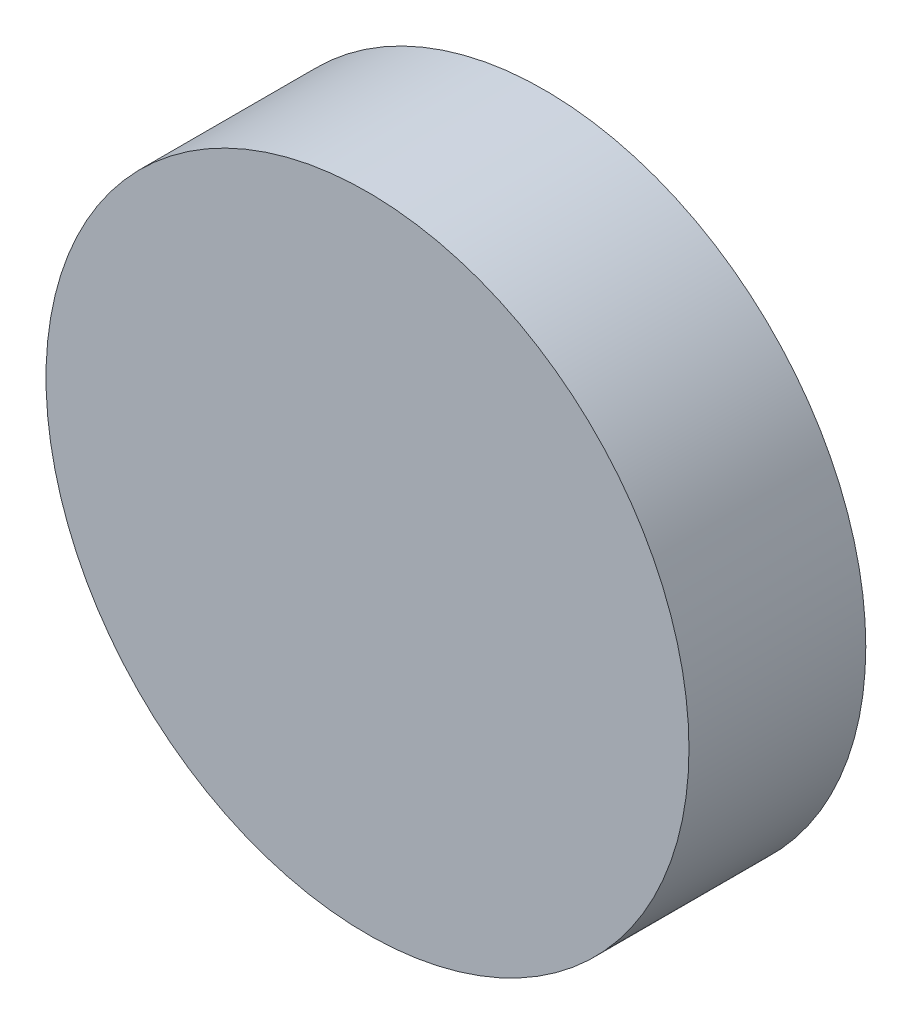
from build123d import *

# Parameters (mm, degrees)
EXTRUDE_START      = 800
EXTRUDE_SKETCH_1_R = 40
EXTRUDE_1_DEPTH    = 22


with BuildPart() as part:
    # Extrude sketch 1 → Extrude 1 (new body)
    with BuildSketch(Plane.XY.offset(EXTRUDE_START)):
        with Locations((860, 225)):
            Circle(EXTRUDE_SKETCH_1_R)
    extrude(amount=EXTRUDE_1_DEPTH)


solid = part.part
